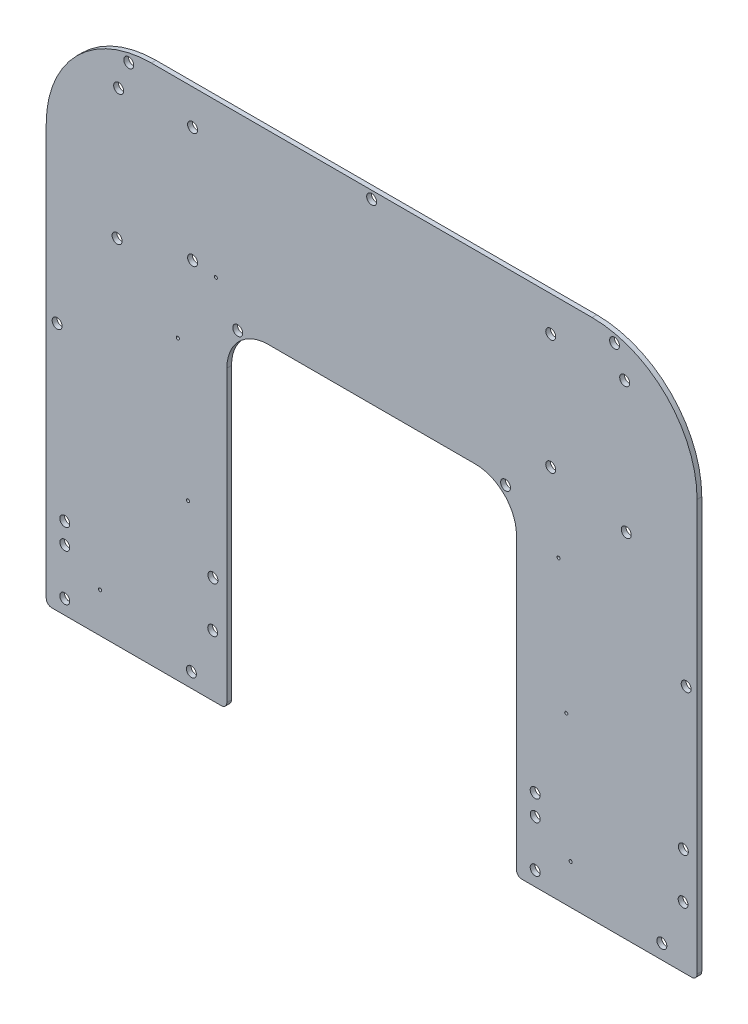
from build123d import *

# Parameters (mm, degrees)
BOSS_EXTRUDE1_DEPTH          = 1.5
M3_CLEARANCE_HOLE1_D         = 3.2
F_1_8_0_125_DIAMETER_HOLE1_D = 3.175
M3_CLEARANCE_HOLE2_D         = 3.2
CUT_EXTRUDE1_DEPTH           = 151.461996863
SKETCH11_R                   = 0.5
CUT_EXTRUDE2_DEPTH           = 151.108502424


with BuildPart() as part:
    # Sketch1 → Boss-Extrude1 (new body)
    with BuildSketch(Plane.XY):
        with BuildLine():
            Line((0, 0), (0, 60))
            Line((0, 60), (-70.75, 60))
            ThreePointArc((-70.75, 60), (-94.79163056, 50.04163056), (-104.75, 26))
            Line((-104.75, 26), (-104.75, -106))
            ThreePointArc((-104.75, -106), (-104.164213562, -107.414213562), (-102.75, -108))
            Line((-102.75, -108), (-48.25, -108))
            ThreePointArc((-48.25, -108), (-46.835786438, -107.414213562), (-46.25, -106))
            Line((-46.25, -106), (-46.25, -13))
            ThreePointArc((-46.25, -13), (-42.442388155, -3.807611845), (-33.25, 0))
            Line((-33.25, 0), (0, 0))
        make_face()
    extrude(amount=BOSS_EXTRUDE1_DEPTH)

    # Mirror1: part across plane


with BuildPart() as part_1:
    add(part.part)
    add(part.part.mirror(Plane(origin=(0, 0, 0), x_dir=(0, 0, 1), z_dir=(1, 0, 0))))

    # M3 Clearance Hole1 (through all)
    with Locations(Plane(origin=(0, 0, 0), x_dir=(-1, 0, 0), z_dir=(0, 0, -1))):
        with Locations((0, 57.25), (78, 56.25), (81.25, 47.5), (81.75, 5.5), (101, -27.75), (43, -0.75), (50.9757, -73.488), (57.8845, -103.079), (98.5499, -81.5652), (98.5499, -103.079), (-100.0866, -73.488), (-93.1778, -103.079), (-52.5124, -81.5652), (-52.5124, -103.079), (-43, -0.75), (-101, -27.75), (-81.75, 5.5), (-81.25, 47.5), (-78, 56.25)):
            Hole(M3_CLEARANCE_HOLE1_D / 2)

    # 1/8 (0.125) Diameter Hole1 (through all)
    with Locations(Plane(origin=(0, 0, 0), x_dir=(-1, 0, 0), z_dir=(0, 0, -1))):
        with Locations((-100.0104, -88.1946), (-52.5124, -88.1946), (51.0519, -88.1946), (98.5499, -88.1946)):
            Hole(F_1_8_0_125_DIAMETER_HOLE1_D / 2)

    # M3 Clearance Hole2 (through all)
    with Locations(Plane(origin=(0, 0, 0), x_dir=(-1, 0, 0), z_dir=(0, 0, -1))):
        with Locations((-57.5, 48.5), (-57.5, 11.5), (57.5, 48.5), (57.5, 11.5)):
            Hole(M3_CLEARANCE_HOLE2_D / 2)

    # Sketch10 → Cut-Extrude1 (cut, through all)
    with BuildSketch(Plane(origin=(0, 0, 0), x_dir=(-1, 0, 0), z_dir=(0, 0, -1))):
        with BuildLine():
            Line((-70.75, 60), (70.75, 60))
            ThreePointArc((70.75, 60), (94.79163056, 50.04163056), (104.75, 26))
            Line((104.75, 26), (104.75, -106))
            ThreePointArc((104.75, -106), (104.164213562, -107.414213562), (102.75, -108))
            Line((102.75, -108), (48.25, -108))
            ThreePointArc((48.25, -108), (46.835786438, -107.414213562), (46.25, -106))
            Line((46.25, -106), (46.25, -13))
            ThreePointArc((46.25, -13), (42.442388155, -3.807611845), (33.25, 0))
            Line((33.25, 0), (-33.25, 0))
            ThreePointArc((-33.25, 0), (-42.442388155, -3.807611845), (-46.25, -13))
            Line((-46.25, -13), (-46.25, -106))
            ThreePointArc((-46.25, -106), (-46.835786438, -107.414213562), (-48.25, -108))
            Line((-48.25, -108), (-102.75, -108))
            ThreePointArc((-102.75, -108), (-104.164213562, -107.414213562), (-104.75, -106))
            Line((-104.75, -106), (-104.75, 26))
            ThreePointArc((-104.75, 26), (-94.79163056, 50.04163056), (-70.75, 60))
        make_face()
        with BuildLine():
            Line((-70.75, 59.75), (70.75, 59.75))
            ThreePointArc((70.75, 59.75), (94.614853865, 49.864853865), (104.5, 26))
            Line((104.5, 26), (104.5, -106))
            ThreePointArc((104.5, -106), (103.987436867, -107.237436867), (102.75, -107.75))
            Line((102.75, -107.75), (48.25, -107.75))
            ThreePointArc((48.25, -107.75), (47.012563133, -107.237436867), (46.5, -106))
            Line((46.5, -106), (46.5, -13))
            ThreePointArc((46.5, -13), (42.619164851, -3.630835149), (33.25, 0.25))
            Line((33.25, 0.25), (-33.25, 0.25))
            ThreePointArc((-33.25, 0.25), (-42.619164851, -3.630835149), (-46.5, -13))
            Line((-46.5, -13), (-46.5, -106))
            ThreePointArc((-46.5, -106), (-47.012563133, -107.237436867), (-48.25, -107.75))
            Line((-48.25, -107.75), (-102.75, -107.75))
            ThreePointArc((-102.75, -107.75), (-103.987436867, -107.237436867), (-104.5, -106))
            Line((-104.5, -106), (-104.5, 26))
            ThreePointArc((-104.5, 26), (-94.614853865, 49.864853865), (-70.75, 59.75))
        make_face(mode=Mode.SUBTRACT)
    extrude(amount=-CUT_EXTRUDE1_DEPTH, mode=Mode.SUBTRACT)

    # Sketch11 → Cut-Extrude2 (cut, through all)
    with BuildSketch(Plane(origin=(0, 0, 0), x_dir=(-1, 0, 0), z_dir=(0, 0, -1))):
        with Locations((-60, -12.5)):
            Circle(SKETCH11_R)
        with Locations((-62.5, -54.44375)):
            Circle(SKETCH11_R)
        with Locations((59, -56.0874)):
            Circle(SKETCH11_R)
        with Locations((62.25, -12.5)):
            Circle(SKETCH11_R)
        with Locations((-63.8789, -94.9764)):
            Circle(SKETCH11_R)
        with Locations((87.1961, -94.9764)):
            Circle(SKETCH11_R)
        with Locations((50.02, 10.5)):
            Circle(SKETCH11_R)
    extrude(amount=-CUT_EXTRUDE2_DEPTH, mode=Mode.SUBTRACT)


solid = part_1.part
